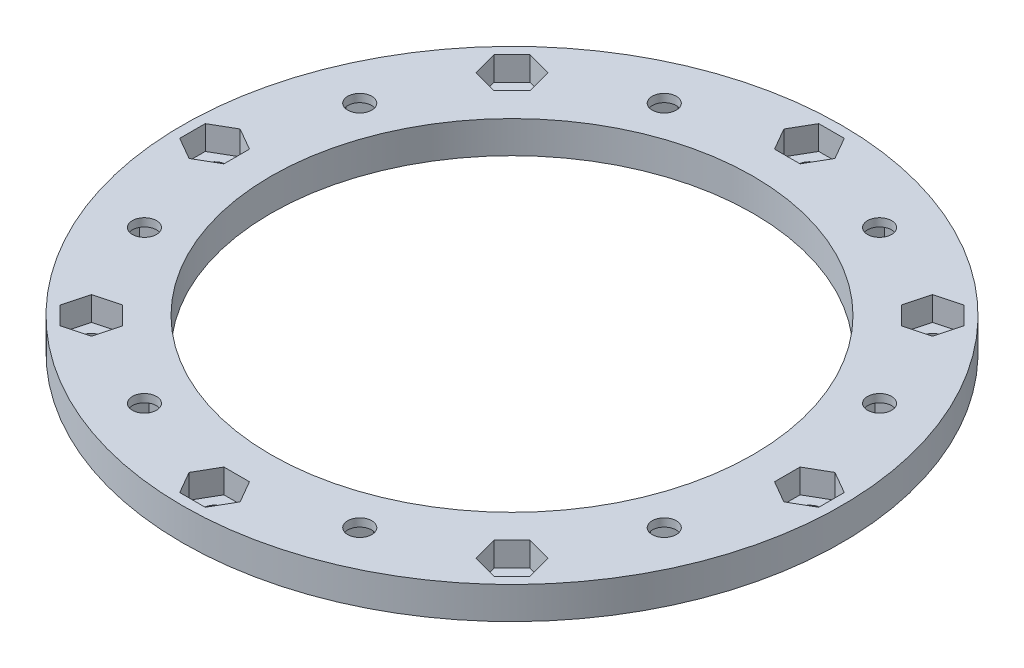
from build123d import *

# Parameters (mm, degrees)
SKETCH_2_R               = 41
SKETCH_2_R_2             = 30
EXTRUDE_1_DEPTH          = 4
SKETCH_3_R               = 1.5
CUT_EXTRUDE_1_DEPTH      = 59.120564347
CUT_EXTRUDE_2_DEPTH      = 3
PATTERN_CIRCULAR_1_COUNT = 24
SKETCH_5_R               = 1.5
CUT_EXTRUDE_3_DEPTH      = 59.120564347
CUT_EXTRUDE_4_DEPTH      = 3
PATTERN_CIRCULAR_2_COUNT = 24


with BuildPart() as part:
    # 草图2 → 凸台-拉伸1 (new body)
    with BuildSketch(Plane(origin=(0, 0, 0), x_dir=(1, 0, 0), z_dir=(0, 1, 0))):
        with Locations(Location((0, 0, 0), (0, 0, 270))):
            Circle(SKETCH_2_R)
        with Locations(Location((0, 0, 0), (0, 0, 270))):
            Circle(SKETCH_2_R_2, mode=Mode.SUBTRACT)
    extrude(amount=EXTRUDE_1_DEPTH)

    # 草图3 → 切除-拉伸1 (cut, through all)
    with BuildSketch(Plane(origin=(0, 4, 0), x_dir=(1, 0, 0), z_dir=(0, 1, 0))):
        with Locations(Location((0, 37, 0), (0, 0, 270))):
            Circle(SKETCH_3_R)
    cut_extrude_1 = extrude(amount=-CUT_EXTRUDE_1_DEPTH, mode=Mode.SUBTRACT)

    # 草图4 → 切除-拉伸2 (cut)
    with BuildSketch(Plane(origin=(0, 4, 0), x_dir=(1, 0, 0), z_dir=(0, 1, 0))):
        Polygon((3.175426481, 37), (1.58771324, 39.75), (-1.58771324, 39.75), (-3.175426481, 37), (-1.58771324, 34.25), (1.58771324, 34.25), align=None)
    cut_extrude_2 = extrude(amount=-CUT_EXTRUDE_2_DEPTH, mode=Mode.SUBTRACT)

    # 阵列(圆周)1: 切除-拉伸1, 切除-拉伸2 ×24 about axis, 16 skipped
    pattern_circular_1_axis = Axis((0, 4, 0), (0, 1, 0))
    add([cut_extrude_1.rotate(pattern_circular_1_axis, i * 360 / PATTERN_CIRCULAR_1_COUNT) for i in range(1, PATTERN_CIRCULAR_1_COUNT) if i not in (1, 2, 4, 5, 7, 8, 10, 11, 13, 14, 16, 17, 19, 20, 22, 23)], mode=Mode.SUBTRACT)
    add([cut_extrude_2.rotate(pattern_circular_1_axis, i * 360 / PATTERN_CIRCULAR_1_COUNT) for i in range(1, PATTERN_CIRCULAR_1_COUNT) if i not in (1, 2, 4, 5, 7, 8, 10, 11, 13, 14, 16, 17, 19, 20, 22, 23)], mode=Mode.SUBTRACT)

    # 草图5 → 切除-拉伸3 (cut, through all)
    with BuildSketch(Plane.XZ):
        with Locations(Location((13.393920133, 32.335783638, 0), (0, 0, 270))):
            Circle(SKETCH_5_R)
    cut_extrude_3 = extrude(amount=-CUT_EXTRUDE_3_DEPTH, mode=Mode.SUBTRACT)

    # 草图6 → 切除-拉伸4 (cut)
    with BuildSketch(Plane.XZ):
        Polygon((12.178737028, 29.402072106), (15.326997295, 29.816548433), (16.5421804, 32.750259965), (14.609103238, 35.26949517), (11.460842971, 34.855018843), (10.245659866, 31.921307311), align=None)
    cut_extrude_4 = extrude(amount=-CUT_EXTRUDE_4_DEPTH, mode=Mode.SUBTRACT)

    # 阵列(圆周)2: 切除-拉伸3, 切除-拉伸4 ×24 about axis, 16 skipped
    pattern_circular_2_axis = Axis((0, 0, 0), (0, 1, 0))
    add([cut_extrude_3.rotate(pattern_circular_2_axis, i * 360 / PATTERN_CIRCULAR_2_COUNT) for i in range(1, PATTERN_CIRCULAR_2_COUNT) if i not in (1, 2, 4, 5, 7, 8, 10, 11, 13, 14, 16, 17, 19, 20, 22, 23)], mode=Mode.SUBTRACT)
    add([cut_extrude_4.rotate(pattern_circular_2_axis, i * 360 / PATTERN_CIRCULAR_2_COUNT) for i in range(1, PATTERN_CIRCULAR_2_COUNT) if i not in (1, 2, 4, 5, 7, 8, 10, 11, 13, 14, 16, 17, 19, 20, 22, 23)], mode=Mode.SUBTRACT)


solid = part.part
